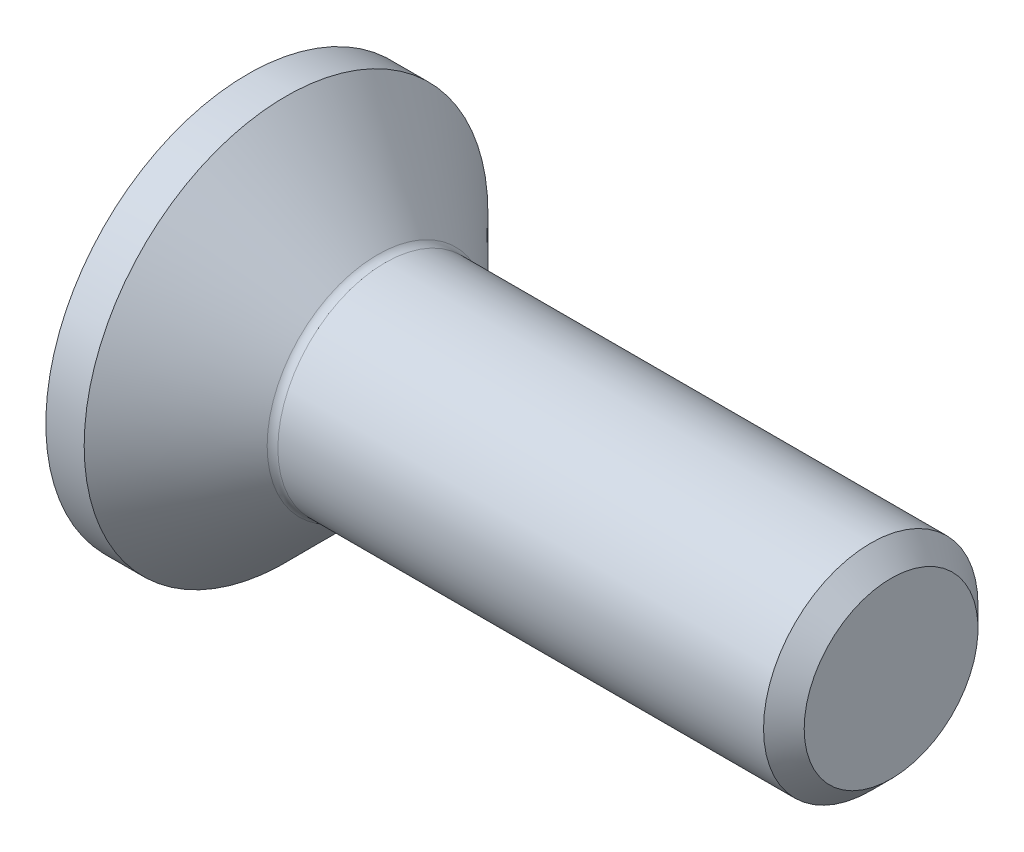
from build123d import *

# Parameters (mm, degrees)
HEXAGONSOCKET_DEPTH = 1.5
HEADFILLET_R        = 0.2
CHAMFER_2_SIZE      = 0.379
SKETCH4_W           = 5
SKETCH4_H           = 5


with BuildPart() as part:
    # Sketch1 → Base (revolve)
    with BuildSketch(Plane.XY, mode=Mode.PRIVATE) as base_sk:
        Polygon((0, 0), (0, 4.48), (2.48, 2), (12, 2), (12, 0), align=None)
    revolve(base_sk.sketch.rotate(Axis((-0.587069181, 0, 0), (1, 0, 0)), 90), axis=Axis((-0.587069181, 0, 0), (1, 0, 0)))

    # Sketch2 → HexagonSocket (cut)
    with BuildSketch(Plane(origin=(0, 0, 0), x_dir=(0, 0, -1), z_dir=(1, 0, 0))):
        Polygon((1.443375673, 0), (0.721687836, 1.25), (-0.721687836, 1.25), (-1.443375673, 0), (-0.721687836, -1.25), (0.721687836, -1.25), align=None)
    extrude(amount=HEXAGONSOCKET_DEPTH, mode=Mode.SUBTRACT)

    # Sketch3 → Cut-Revolve1 (revolve, cut)
    with BuildSketch(Plane.XY, mode=Mode.PRIVATE) as cut_revolve1_sk:
        Polygon((1.5, 1.25), (2.221687836, 0), (1.5, 0), align=None)
    revolve(cut_revolve1_sk.sketch.rotate(Axis((-0.439109555, 0, 0), (1, 0, 0)), 90), axis=Axis((-0.439109555, 0, 0), (1, 0, 0)), mode=Mode.SUBTRACT)

    # HeadFillet
    headfillet_edges = [part.edges().sort_by_distance(p)[0] for p in [
        (2.48, 0, -2),
    ]]
    fillet(headfillet_edges, radius=HEADFILLET_R)

    # Chamfer 2
    chamfer_2_edges = [part.edges().sort_by_distance(p)[0] for p in [
        (12, 0, -2),
    ]]
    chamfer(chamfer_2_edges, length=CHAMFER_2_SIZE)

    # Sketch4 → Cut-Revolve2 (revolve, cut)
    with BuildSketch(Plane(origin=(0, 0, 0), x_dir=(1, 0, 0), z_dir=(0, 1, 0)), mode=Mode.PRIVATE) as cut_revolve2_sk:
        with Locations((0.5, 6.265)):
            Rectangle(SKETCH4_W, SKETCH4_H)
    revolve(cut_revolve2_sk.sketch.rotate(Axis((11.853138686, 0, 0), (-1, 0, 0)), 180), axis=Axis((11.853138686, 0, 0), (-1, 0, 0)), mode=Mode.SUBTRACT)


solid = part.part
